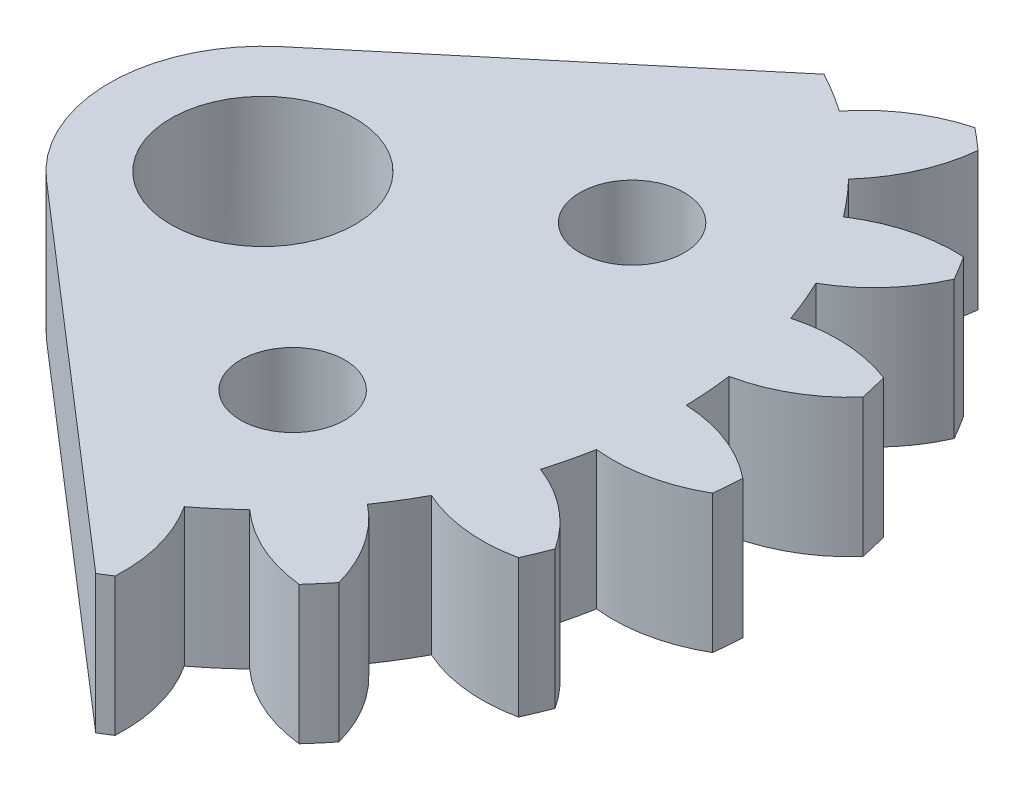
from build123d import *

# Parameters (mm, degrees)
EXTRUDE_2_DEPTH      = 10
EXTRUDE_START        = -10
EXTRUDE_3_DEPTH      = 10
CUT_EXTRUDE_2_DEPTH  = 48.669538272
SKETCH_6_R           = 6
CUT_EXTRUDE_3_DEPTH  = 10
EXTRUDE_5_DEPTH      = 10
CUT_EXTRUDE_5_DEPTH  = 10
CUT_EXTRUDE_START    = -10
CUT_EXTRUDE_6_DEPTH  = 10
FILLET_1_R           = 10
EXTRUDE_7_DEPTH      = 10
CUT_EXTRUDE_START_2  = -7
CUT_EXTRUDE_8_DEPTH  = 7
SKETCH_18_R          = 6
EXTRUDE_8_DEPTH      = 9
CUT_EXTRUDE_9_DEPTH  = 3
SKETCH_20_R          = 3.4
CUT_EXTRUDE_10_DEPTH = 45.259352307


with BuildPart() as part:
    # 草图1 → 凸台-拉伸2 (new body)
    with BuildSketch(Plane(origin=(0, 0, 0), x_dir=(1, 0, 0), z_dir=(0, 1, 0))):
        with BuildLine():
            ThreePointArc((-0.606477084, 26.993187762), (-18.876243253, -19.305114365), (27, 0))
            ThreePointArc((27, 0), (20.726616116, 17.303392279), (4.821675232, 26.56598291))
            ThreePointArc((4.821675232, 26.56598291), (2.118395585, 26.916768011), (-0.606477084, 26.993187762))
        make_face()
    extrude(amount=EXTRUDE_2_DEPTH)

    # 草图3 → 凸台-拉伸3 (add)
    with BuildSketch(Plane(origin=(0, 10, 0), x_dir=(1, 0, 0), z_dir=(0, 1, 0)).offset(EXTRUDE_START)):
        with BuildLine():
            ThreePointArc((26.755730746, 3.623654542), (29.776890365, 4.775668185), (32.289554959, 6.810627033))
            ThreePointArc((32.289554959, 6.810627033), (32.088207373, 7.703697007), (31.862164101, 8.590838072))
            ThreePointArc((31.862164101, 8.590838072), (28.699511571, 9.263273827), (25.484635391, 8.918147734))
            ThreePointArc((25.484635391, 8.918147734), (26.253987851, 6.303024824), (26.755730746, 3.623654542))
        make_face()
        with BuildLine():
            ThreePointArc((32.813791147, -3.500730003), (32.898272013, -2.589150159), (32.957433752, -1.675577656))
            ThreePointArc((32.957433752, -1.675577656), (30.15736653, -0.05873987), (26.993187762, 0.606477084))
            ThreePointArc((26.993187762, 0.606477084), (26.916768011, -2.118395585), (26.56598291, -4.821675232))
            ThreePointArc((26.56598291, -4.821675232), (29.795268245, -4.659634815), (32.813791147, -3.500730003))
        make_face()
        with BuildLine():
            ThreePointArc((24.326441239, 11.714275763), (26.843742988, 13.743495509), (28.604592156, 16.455312443))
            ThreePointArc((28.604592156, 16.455312443), (28.137125424, 17.242452636), (27.648003832, 18.016322714))
            ThreePointArc((27.648003832, 18.016322714), (24.432348458, 17.678533741), (21.481469346, 16.356847947))
            ThreePointArc((21.481469346, 16.356847947), (23.021284438, 14.107461247), (24.326441239, 11.714275763))
        make_face()
        with BuildLine():
            ThreePointArc((30.125984831, -13.469411196), (30.488024573, -12.628553268), (30.826600159, -11.777976169))
            ThreePointArc((30.826600159, -11.777976169), (28.663208335, -9.3750037), (25.859458842, -7.764559768))
            ThreePointArc((25.859458842, -7.764559768), (24.944747378, -10.332452674), (23.77577157, -12.79502584))
            ThreePointArc((23.77577157, -12.79502584), (26.897077674, -13.638820294), (30.125984831, -13.469411196))
        make_face()
        with BuildLine():
            ThreePointArc((19.515910171, 18.658222053), (21.282943016, 21.366013737), (22.119612574, 24.48923722))
            ThreePointArc((22.119612574, 24.48923722), (21.431785595, 25.093396865), (20.727464312, 25.678244161))
            ThreePointArc((20.727464312, 25.678244161), (17.773576848, 24.363295599), (15.375547411, 22.194425918))
            ThreePointArc((15.375547411, 22.194425918), (17.535097305, 20.530961071), (19.515910171, 18.658222053))
        make_face()
        with BuildLine():
            ThreePointArc((24.48923722, -22.119612574), (25.093396865, -21.431785595), (25.678244161, -20.727464312))
            ThreePointArc((25.678244161, -20.727464312), (24.363295599, -17.773576848), (22.194425918, -15.375547411))
            ThreePointArc((22.194425918, -15.375547411), (20.530961071, -17.535097305), (18.658222053, -19.515910171))
            ThreePointArc((18.658222053, -19.515910171), (21.366013737, -21.282943016), (24.48923722, -22.119612574))
        make_face()
        with BuildLine():
            ThreePointArc((12.79502584, 23.77577157), (13.638820294, 26.897077674), (13.469411196, 30.125984831))
            ThreePointArc((13.469411196, 30.125984831), (12.628553268, 30.488024573), (11.777976169, 30.826600159))
            ThreePointArc((11.777976169, 30.826600159), (9.3750037, 28.663208335), (7.764559768, 25.859458842))
            ThreePointArc((7.764559768, 25.859458842), (10.332452674, 24.944747378), (12.79502584, 23.77577157))
        make_face()
        with BuildLine():
            ThreePointArc((16.455312443, -28.604592156), (17.242452636, -28.137125424), (18.016322714, -27.648003832))
            ThreePointArc((18.016322714, -27.648003832), (17.678533741, -24.432348458), (16.356847947, -21.481469346))
            ThreePointArc((16.356847947, -21.481469346), (14.107461247, -23.021284438), (11.714275763, -24.326441239))
            ThreePointArc((11.714275763, -24.326441239), (13.743495509, -26.843742988), (16.455312443, -28.604592156))
        make_face()
        with BuildLine():
            ThreePointArc((4.821675232, 26.56598291), (4.659634815, 29.795268245), (3.500730003, 32.813791147))
            ThreePointArc((3.500730003, 32.813791147), (2.589150159, 32.898272013), (1.675577656, 32.957433752))
            ThreePointArc((1.675577656, 32.957433752), (0.05873987, 30.15736653), (-0.606477084, 26.993187762))
            ThreePointArc((-0.606477084, 26.993187762), (2.118395585, 26.916768011), (4.821675232, 26.56598291))
        make_face()
        with BuildLine():
            ThreePointArc((6.810627033, -32.289554959), (7.703697007, -32.088207373), (8.590838072, -31.862164101))
            ThreePointArc((8.590838072, -31.862164101), (9.263273827, -28.699511571), (8.918147734, -25.484635391))
            ThreePointArc((8.918147734, -25.484635391), (6.303024824, -26.253987851), (3.623654542, -26.755730746))
            ThreePointArc((3.623654542, -26.755730746), (4.775668185, -29.776890365), (6.810627033, -32.289554959))
        make_face()
        with BuildLine():
            ThreePointArc((-3.623654542, 26.755730746), (-4.775668185, 29.776890365), (-6.810627033, 32.289554959))
            ThreePointArc((-6.810627033, 32.289554959), (-7.703697007, 32.088207373), (-8.590838072, 31.862164101))
            ThreePointArc((-8.590838072, 31.862164101), (-9.263273827, 28.699511571), (-8.918147734, 25.484635391))
            ThreePointArc((-8.918147734, 25.484635391), (-6.303024824, 26.253987851), (-3.623654542, 26.755730746))
        make_face()
        with BuildLine():
            ThreePointArc((-3.500730003, -32.813791147), (-2.589150159, -32.898272013), (-1.675577656, -32.957433752))
            ThreePointArc((-1.675577656, -32.957433752), (-0.05873987, -30.15736653), (0.606477084, -26.993187762))
            ThreePointArc((0.606477084, -26.993187762), (-2.118395585, -26.916768011), (-4.821675232, -26.56598291))
            ThreePointArc((-4.821675232, -26.56598291), (-4.659634815, -29.795268245), (-3.500730003, -32.813791147))
        make_face()
        with BuildLine():
            ThreePointArc((-11.714275763, 24.326441239), (-13.743495509, 26.843742988), (-16.455312443, 28.604592156))
            ThreePointArc((-16.455312443, 28.604592156), (-17.242452636, 28.137125424), (-18.016322714, 27.648003832))
            ThreePointArc((-18.016322714, 27.648003832), (-17.678533741, 24.432348458), (-16.356847947, 21.481469346))
            ThreePointArc((-16.356847947, 21.481469346), (-14.107461247, 23.021284438), (-11.714275763, 24.326441239))
        make_face()
        with BuildLine():
            ThreePointArc((-13.469411196, -30.125984831), (-12.628553268, -30.488024573), (-11.777976169, -30.826600159))
            ThreePointArc((-11.777976169, -30.826600159), (-9.3750037, -28.663208335), (-7.764559768, -25.859458842))
            ThreePointArc((-7.764559768, -25.859458842), (-10.332452674, -24.944747378), (-12.79502584, -23.77577157))
            ThreePointArc((-12.79502584, -23.77577157), (-13.638820294, -26.897077674), (-13.469411196, -30.125984831))
        make_face()
        with BuildLine():
            ThreePointArc((-18.658222053, 19.515910171), (-21.366013737, 21.282943016), (-24.48923722, 22.119612574))
            ThreePointArc((-24.48923722, 22.119612574), (-25.093396865, 21.431785595), (-25.678244161, 20.727464312))
            ThreePointArc((-25.678244161, 20.727464312), (-24.363295599, 17.773576848), (-22.194425918, 15.375547411))
            ThreePointArc((-22.194425918, 15.375547411), (-20.530961071, 17.535097305), (-18.658222053, 19.515910171))
        make_face()
        with BuildLine():
            ThreePointArc((-22.119612574, -24.48923722), (-21.431785595, -25.093396865), (-20.727464312, -25.678244161))
            ThreePointArc((-20.727464312, -25.678244161), (-17.773576848, -24.363295599), (-15.375547411, -22.194425918))
            ThreePointArc((-15.375547411, -22.194425918), (-17.535097305, -20.530961071), (-19.515910171, -18.658222053))
            ThreePointArc((-19.515910171, -18.658222053), (-21.282943016, -21.366013737), (-22.119612574, -24.48923722))
        make_face()
        with BuildLine():
            ThreePointArc((-23.77577157, 12.79502584), (-26.897077674, 13.638820294), (-30.125984831, 13.469411196))
            ThreePointArc((-30.125984831, 13.469411196), (-30.488024573, 12.628553268), (-30.826600159, 11.777976169))
            ThreePointArc((-30.826600159, 11.777976169), (-28.663208335, 9.3750037), (-25.859458842, 7.764559768))
            ThreePointArc((-25.859458842, 7.764559768), (-24.944747378, 10.332452674), (-23.77577157, 12.79502584))
        make_face()
        with BuildLine():
            ThreePointArc((-28.604592156, -16.455312443), (-28.137125424, -17.242452636), (-27.648003832, -18.016322714))
            ThreePointArc((-27.648003832, -18.016322714), (-24.432348458, -17.678533741), (-21.481469346, -16.356847947))
            ThreePointArc((-21.481469346, -16.356847947), (-23.021284438, -14.107461247), (-24.326441239, -11.714275763))
            ThreePointArc((-24.326441239, -11.714275763), (-26.843742988, -13.743495509), (-28.604592156, -16.455312443))
        make_face()
        with BuildLine():
            ThreePointArc((-26.56598291, 4.821675232), (-29.795268245, 4.659634815), (-32.813791147, 3.500730003))
            ThreePointArc((-32.813791147, 3.500730003), (-32.898272013, 2.589150159), (-32.957433752, 1.675577656))
            ThreePointArc((-32.957433752, 1.675577656), (-30.15736653, 0.05873987), (-26.993187762, -0.606477084))
            ThreePointArc((-26.993187762, -0.606477084), (-26.916768011, 2.118395585), (-26.56598291, 4.821675232))
        make_face()
        with BuildLine():
            ThreePointArc((-32.289554959, -6.810627033), (-32.088207373, -7.703697007), (-31.862164101, -8.590838072))
            ThreePointArc((-31.862164101, -8.590838072), (-28.699511571, -9.263273827), (-25.484635391, -8.918147734))
            ThreePointArc((-25.484635391, -8.918147734), (-26.253987851, -6.303024824), (-26.755730746, -3.623654542))
            ThreePointArc((-26.755730746, -3.623654542), (-29.776890365, -4.775668185), (-32.289554959, -6.810627033))
        make_face()
    extrude(amount=EXTRUDE_3_DEPTH)

    # 草图4 → 切除-拉伸2 (cut, through all)
    with BuildSketch(Plane(origin=(0, 10, 0), x_dir=(1, 0, 0), z_dir=(0, 1, 0))):
        with BuildLine():
            Line((68.70942434, -72.656830422), (-6.542169106, -7.563069707))
            ThreePointArc((-6.542169106, -7.563069707), (-9.614988938, -2.748088014), (-9.550796477, 2.963492306))
            Line((-9.550796477, 2.963492306), (-2.118395585, 26.916768011))
            Line((-2.118395585, 26.916768011), (19.935579671, 97.992717399))
            ThreePointArc((19.935579671, 97.992717399), (-96.149889375, -27.480880138), (68.70942434, -72.656830422))
        make_face()
    extrude(amount=-CUT_EXTRUDE_2_DEPTH, mode=Mode.SUBTRACT)

    # 草图6 → 切除-拉伸3 (cut)
    with BuildSketch(Plane(origin=(0, 10, 0), x_dir=(1, 0, 0), z_dir=(0, 1, 0))):
        Circle(SKETCH_6_R)
    extrude(amount=-CUT_EXTRUDE_3_DEPTH, mode=Mode.SUBTRACT)

    # 草图9 → 凸台-拉伸5 (add)
    with BuildSketch(Plane(origin=(0, 10, 0), x_dir=(1, 0, 0), z_dir=(0, 1, 0)).offset(EXTRUDE_START)):
        with BuildLine():
            Line((-18.337271569, 36.810995995), (-10, 0))
            ThreePointArc((-10, 0), (-9.887061363, 1.49867195), (-9.550796477, 2.963492306))
            Line((-9.550796477, 2.963492306), (-2.118395585, 26.916768011))
            ThreePointArc((-2.118395585, 26.916768011), (-1.362972032, 26.965576338), (-0.606477084, 26.993187762))
            ThreePointArc((-0.606477084, 26.993187762), (0.05873987, 30.15736653), (1.675577656, 32.957433752))
            ThreePointArc((1.675577656, 32.957433752), (2.589150159, 32.898272013), (3.500730003, 32.813791147))
            ThreePointArc((3.500730003, 32.813791147), (4.659634815, 29.795268245), (4.821675232, 26.56598291))
            Line((4.821675232, 26.56598291), (7.168022985, 33.612773021))
            ThreePointArc((7.168022985, 33.612773021), (-5.303969741, 37.450057719), (-18.337271569, 36.810995995))
        make_face()
    extrude(amount=EXTRUDE_5_DEPTH)

    # 草图10 → 切除-拉伸5 (cut)
    with BuildSketch(Plane(origin=(0, 10, 0), x_dir=(1, 0, 0), z_dir=(0, 1, 0))):
        with BuildLine():
            ThreePointArc((-5.279363296, 23.309618684), (-1.860818549, 25.451670203), (-0.526815852, 29.258935587))
            ThreePointArc((-0.526815852, 29.258935587), (-11.392813156, 33.06620097), (-5.279363296, 23.309618684))
        make_face()
    extrude(amount=-CUT_EXTRUDE_5_DEPTH, mode=Mode.SUBTRACT)

    # 草图11 → 切除-拉伸6 (cut)
    with BuildSketch(Plane(origin=(0, 10, 0), x_dir=(1, 0, 0), z_dir=(0, 1, 0)).offset(CUT_EXTRUDE_START)):
        with BuildLine():
            Line((0, 36.394498532), (3.500730003, 32.813791147))
            ThreePointArc((3.500730003, 32.813791147), (4.659634815, 29.795268245), (4.821675232, 26.56598291))
            Line((4.821675232, 26.56598291), (7.168022985, 33.612773021))
            ThreePointArc((7.168022985, 33.612773021), (3.655030847, 35.186640305), (0, 36.394498532))
        make_face()
    extrude(amount=CUT_EXTRUDE_6_DEPTH, mode=Mode.SUBTRACT)

    # 圆角1
    fillet_1_edges = [part.edges().sort_by_distance(p)[0] for p in [
        (-18.337271569, 5, -36.810995995),
    ]]
    fillet(fillet_1_edges, radius=FILLET_1_R)

    # 草图16 → 凸台-拉伸7 (add)
    with BuildSketch(Plane(origin=(0, 10, 0), x_dir=(1, 0, 0), z_dir=(0, 1, 0)).offset(EXTRUDE_START)):
        with BuildLine():
            Line((-14.687023148, 20.694298958), (-15.716384779, 25.239170332))
            ThreePointArc((-15.716384779, 25.239170332), (-13.300434171, 34.242814336), (-4.508428545, 37.341694744))
            ThreePointArc((-4.508428545, 37.341694744), (-2.23974925, 36.936946702), (0, 36.394498532))
            Line((0, 36.394498532), (3.500730003, 32.813791147))
            ThreePointArc((3.500730003, 32.813791147), (4.659634815, 29.795268245), (4.821675232, 26.56598291))
            ThreePointArc((4.821675232, 26.56598291), (5.055758182, 27.903426031), (5.134134034, 29.258935587))
            ThreePointArc((5.134134034, 29.258935587), (-11.291805035, 40.055130201), (-14.687023148, 20.694298958))
        make_face()
    extrude(amount=EXTRUDE_7_DEPTH)

    # 草图17 → 切除-拉伸8 (cut)
    with BuildSketch(Plane(origin=(0, 10, 0), x_dir=(1, 0, 0), z_dir=(0, 1, 0)).offset(CUT_EXTRUDE_START_2)):
        with BuildLine():
            Line((-14.687023148, 20.694298958), (-10, 0))
            ThreePointArc((-10, 0), (-9.09455032, -4.158022904), (-6.542169106, -7.563069707))
            Line((-6.542169106, -7.563069707), (17.242452636, -28.137125424))
            ThreePointArc((17.242452636, -28.137125424), (17.631083908, -27.895248345), (18.016322714, -27.648003832))
            ThreePointArc((18.016322714, -27.648003832), (17.678533741, -24.432348458), (16.356847947, -21.481469346))
            ThreePointArc((16.356847947, -21.481469346), (17.535097305, -20.530961071), (18.658222053, -19.515910171))
            ThreePointArc((18.658222053, -19.515910171), (21.366013737, -21.282943016), (24.48923722, -22.119612574))
            ThreePointArc((24.48923722, -22.119612574), (25.093396865, -21.431785595), (25.678244161, -20.727464312))
            ThreePointArc((25.678244161, -20.727464312), (24.363295599, -17.773576848), (22.194425918, -15.375547411))
            ThreePointArc((22.194425918, -15.375547411), (23.021284438, -14.107461247), (23.77577157, -12.79502584))
            ThreePointArc((23.77577157, -12.79502584), (26.897077674, -13.638820294), (30.125984831, -13.469411196))
            ThreePointArc((30.125984831, -13.469411196), (30.488024573, -12.628553268), (30.826600159, -11.777976169))
            ThreePointArc((30.826600159, -11.777976169), (28.663208335, -9.3750037), (25.859458842, -7.764559768))
            ThreePointArc((25.859458842, -7.764559768), (26.253987851, -6.303024824), (26.56598291, -4.821675232))
            ThreePointArc((26.56598291, -4.821675232), (29.795268245, -4.659634815), (32.813791147, -3.500730003))
            ThreePointArc((32.813791147, -3.500730003), (32.898272013, -2.589150159), (32.957433752, -1.675577656))
            ThreePointArc((32.957433752, -1.675577656), (30.15736653, -0.05873987), (26.993187762, 0.606477084))
            ThreePointArc((26.993187762, 0.606477084), (26.916768011, 2.118395585), (26.755730746, 3.623654542))
            ThreePointArc((26.755730746, 3.623654542), (29.776890365, 4.775668185), (32.289554959, 6.810627033))
            ThreePointArc((32.289554959, 6.810627033), (32.088207373, 7.703697007), (31.862164101, 8.590838072))
            ThreePointArc((31.862164101, 8.590838072), (28.699511571, 9.263273827), (25.484635391, 8.918147734))
            ThreePointArc((25.484635391, 8.918147734), (24.944747378, 10.332452674), (24.326441239, 11.714275763))
            ThreePointArc((24.326441239, 11.714275763), (26.843742988, 13.743495509), (28.604592156, 16.455312443))
            ThreePointArc((28.604592156, 16.455312443), (28.137125424, 17.242452636), (27.648003832, 18.016322714))
            ThreePointArc((27.648003832, 18.016322714), (24.432348458, 17.678533741), (21.481469346, 16.356847947))
            ThreePointArc((21.481469346, 16.356847947), (20.530961071, 17.535097305), (19.515910171, 18.658222053))
            ThreePointArc((19.515910171, 18.658222053), (21.282943016, 21.366013737), (22.119612574, 24.48923722))
            ThreePointArc((22.119612574, 24.48923722), (21.431785595, 25.093396865), (20.727464312, 25.678244161))
            ThreePointArc((20.727464312, 25.678244161), (17.773576848, 24.363295599), (15.375547411, 22.194425918))
            ThreePointArc((15.375547411, 22.194425918), (14.107461247, 23.021284438), (12.79502584, 23.77577157))
            ThreePointArc((12.79502584, 23.77577157), (13.638820294, 26.897077674), (13.469411196, 30.125984831))
            ThreePointArc((13.469411196, 30.125984831), (12.628553268, 30.488024573), (11.777976169, 30.826600159))
            ThreePointArc((11.777976169, 30.826600159), (9.3750037, 28.663208335), (7.764559768, 25.859458842))
            ThreePointArc((7.764559768, 25.859458842), (6.303024824, 26.253987851), (4.821675232, 26.56598291))
            ThreePointArc((4.821675232, 26.56598291), (-10.016400615, 40.520847385), (-14.687023148, 20.694298958))
        make_face()
    extrude(amount=CUT_EXTRUDE_8_DEPTH, mode=Mode.SUBTRACT)

    # 草图18 → 凸台-拉伸8 (add)
    with BuildSketch(Plane(origin=(0, 3, 0), x_dir=(1, 0, 0), z_dir=(0, 1, 0))):
        with BuildLine():
            ThreePointArc((15.375547411, 22.194425918), (14.107461247, 23.021284438), (12.79502584, 23.77577157))
            Line((12.79502584, 23.77577157), (-6.424458971, 7.663310442))
            ThreePointArc((-6.424458971, 7.663310442), (-9.999701197, 0.0773044), (-6.542169106, -7.563069707))
            Line((-6.542169106, -7.563069707), (17.242452636, -28.137125424))
            ThreePointArc((17.242452636, -28.137125424), (17.631083908, -27.895248345), (18.016322714, -27.648003832))
            ThreePointArc((18.016322714, -27.648003832), (17.678533741, -24.432348458), (16.356847947, -21.481469346))
            ThreePointArc((16.356847947, -21.481469346), (17.535097305, -20.530961071), (18.658222053, -19.515910171))
            ThreePointArc((18.658222053, -19.515910171), (21.366013737, -21.282943016), (24.48923722, -22.119612574))
            ThreePointArc((24.48923722, -22.119612574), (25.093396865, -21.431785595), (25.678244161, -20.727464312))
            ThreePointArc((25.678244161, -20.727464312), (24.363295599, -17.773576848), (22.194425918, -15.375547411))
            ThreePointArc((22.194425918, -15.375547411), (23.021284438, -14.107461247), (23.77577157, -12.79502584))
            ThreePointArc((23.77577157, -12.79502584), (26.897077674, -13.638820294), (30.125984831, -13.469411196))
            ThreePointArc((30.125984831, -13.469411196), (30.488024573, -12.628553268), (30.826600159, -11.777976169))
            ThreePointArc((30.826600159, -11.777976169), (28.663208335, -9.3750037), (25.859458842, -7.764559768))
            ThreePointArc((25.859458842, -7.764559768), (26.253987851, -6.303024824), (26.56598291, -4.821675232))
            ThreePointArc((26.56598291, -4.821675232), (29.795268245, -4.659634815), (32.813791147, -3.500730003))
            ThreePointArc((32.813791147, -3.500730003), (32.898272013, -2.589150159), (32.957433752, -1.675577656))
            ThreePointArc((32.957433752, -1.675577656), (30.15736653, -0.05873987), (26.993187762, 0.606477084))
            ThreePointArc((26.993187762, 0.606477084), (26.916768011, 2.118395585), (26.755730746, 3.623654542))
            ThreePointArc((26.755730746, 3.623654542), (29.776890365, 4.775668185), (32.289554959, 6.810627033))
            ThreePointArc((32.289554959, 6.810627033), (32.088207373, 7.703697007), (31.862164101, 8.590838072))
            ThreePointArc((31.862164101, 8.590838072), (28.699511571, 9.263273827), (25.484635391, 8.918147734))
            ThreePointArc((25.484635391, 8.918147734), (24.944747378, 10.332452674), (24.326441239, 11.714275763))
            ThreePointArc((24.326441239, 11.714275763), (26.843742988, 13.743495509), (28.604592156, 16.455312443))
            ThreePointArc((28.604592156, 16.455312443), (28.137125424, 17.242452636), (27.648003832, 18.016322714))
            ThreePointArc((27.648003832, 18.016322714), (24.432348458, 17.678533741), (21.481469346, 16.356847947))
            ThreePointArc((21.481469346, 16.356847947), (20.530961071, 17.535097305), (19.515910171, 18.658222053))
            ThreePointArc((19.515910171, 18.658222053), (21.282943016, 21.366013737), (22.119612574, 24.48923722))
            ThreePointArc((22.119612574, 24.48923722), (21.431785595, 25.093396865), (20.727464312, 25.678244161))
            ThreePointArc((20.727464312, 25.678244161), (17.773576848, 24.363295599), (15.375547411, 22.194425918))
        make_face()
        Circle(SKETCH_18_R, mode=Mode.SUBTRACT)
    extrude(amount=EXTRUDE_8_DEPTH)

    # 草图19 → 切除-拉伸9 (cut)
    with BuildSketch(Plane.XZ):
        with BuildLine():
            Line((-10, 0), (-14.687023148, -20.694298958))
            ThreePointArc((-14.687023148, -20.694298958), (-10.016400615, -40.520847385), (4.821675232, -26.56598291))
            ThreePointArc((4.821675232, -26.56598291), (6.303024824, -26.253987851), (7.764559768, -25.859458842))
            ThreePointArc((7.764559768, -25.859458842), (9.3750037, -28.663208335), (11.777976169, -30.826600159))
            ThreePointArc((11.777976169, -30.826600159), (12.628553268, -30.488024573), (13.469411196, -30.125984831))
            ThreePointArc((13.469411196, -30.125984831), (13.638820294, -26.897077674), (12.79502584, -23.77577157))
            ThreePointArc((12.79502584, -23.77577157), (14.107461247, -23.021284438), (15.375547411, -22.194425918))
            ThreePointArc((15.375547411, -22.194425918), (17.773576848, -24.363295599), (20.727464312, -25.678244161))
            ThreePointArc((20.727464312, -25.678244161), (21.431785595, -25.093396865), (22.119612574, -24.48923722))
            ThreePointArc((22.119612574, -24.48923722), (21.282943016, -21.366013737), (19.515910171, -18.658222053))
            ThreePointArc((19.515910171, -18.658222053), (20.530961071, -17.535097305), (21.481469346, -16.356847947))
            ThreePointArc((21.481469346, -16.356847947), (24.432348458, -17.678533741), (27.648003832, -18.016322714))
            ThreePointArc((27.648003832, -18.016322714), (28.137125424, -17.242452636), (28.604592156, -16.455312443))
            ThreePointArc((28.604592156, -16.455312443), (26.843742988, -13.743495509), (24.326441239, -11.714275763))
            ThreePointArc((24.326441239, -11.714275763), (24.944747378, -10.332452674), (25.484635391, -8.918147734))
            ThreePointArc((25.484635391, -8.918147734), (28.699511571, -9.263273827), (31.862164101, -8.590838072))
            ThreePointArc((31.862164101, -8.590838072), (32.088207373, -7.703697007), (32.289554959, -6.810627033))
            ThreePointArc((32.289554959, -6.810627033), (29.776890365, -4.775668185), (26.755730746, -3.623654542))
            ThreePointArc((26.755730746, -3.623654542), (26.916768011, -2.118395585), (26.993187762, -0.606477084))
            ThreePointArc((26.993187762, -0.606477084), (30.15736653, 0.05873987), (32.957433752, 1.675577656))
            ThreePointArc((32.957433752, 1.675577656), (32.898272013, 2.589150159), (32.813791147, 3.500730003))
            ThreePointArc((32.813791147, 3.500730003), (29.795268245, 4.659634815), (26.56598291, 4.821675232))
            ThreePointArc((26.56598291, 4.821675232), (26.253987851, 6.303024824), (25.859458842, 7.764559768))
            ThreePointArc((25.859458842, 7.764559768), (28.663208335, 9.3750037), (30.826600159, 11.777976169))
            ThreePointArc((30.826600159, 11.777976169), (30.488024573, 12.628553268), (30.125984831, 13.469411196))
            ThreePointArc((30.125984831, 13.469411196), (26.897077674, 13.638820294), (23.77577157, 12.79502584))
            ThreePointArc((23.77577157, 12.79502584), (23.021284438, 14.107461247), (22.194425918, 15.375547411))
            ThreePointArc((22.194425918, 15.375547411), (24.363295599, 17.773576848), (25.678244161, 20.727464312))
            ThreePointArc((25.678244161, 20.727464312), (25.093396865, 21.431785595), (24.48923722, 22.119612574))
            ThreePointArc((24.48923722, 22.119612574), (21.366013737, 21.282943016), (18.658222053, 19.515910171))
            ThreePointArc((18.658222053, 19.515910171), (17.535097305, 20.530961071), (16.356847947, 21.481469346))
            ThreePointArc((16.356847947, 21.481469346), (17.678533741, 24.432348458), (18.016322714, 27.648003832))
            ThreePointArc((18.016322714, 27.648003832), (17.631083908, 27.895248345), (17.242452636, 28.137125424))
            Line((17.242452636, 28.137125424), (-6.542169106, 7.563069707))
            ThreePointArc((-6.542169106, 7.563069707), (-9.09455032, 4.158022904), (-10, 0))
        make_face()
    extrude(amount=-CUT_EXTRUDE_9_DEPTH, mode=Mode.SUBTRACT)

    # 草图20 → 切除-拉伸10 (cut, through all)
    with BuildSketch(Plane(origin=(0, 12, 0), x_dir=(1, 0, 0), z_dir=(0, 1, 0))):
        with Locations((13.307104398, -11.365340846)):
            Circle(SKETCH_20_R)
        with Locations((14.921202876, 9.143724883)):
            Circle(SKETCH_20_R)
    extrude(amount=-CUT_EXTRUDE_10_DEPTH, mode=Mode.SUBTRACT)


solid = part.part
